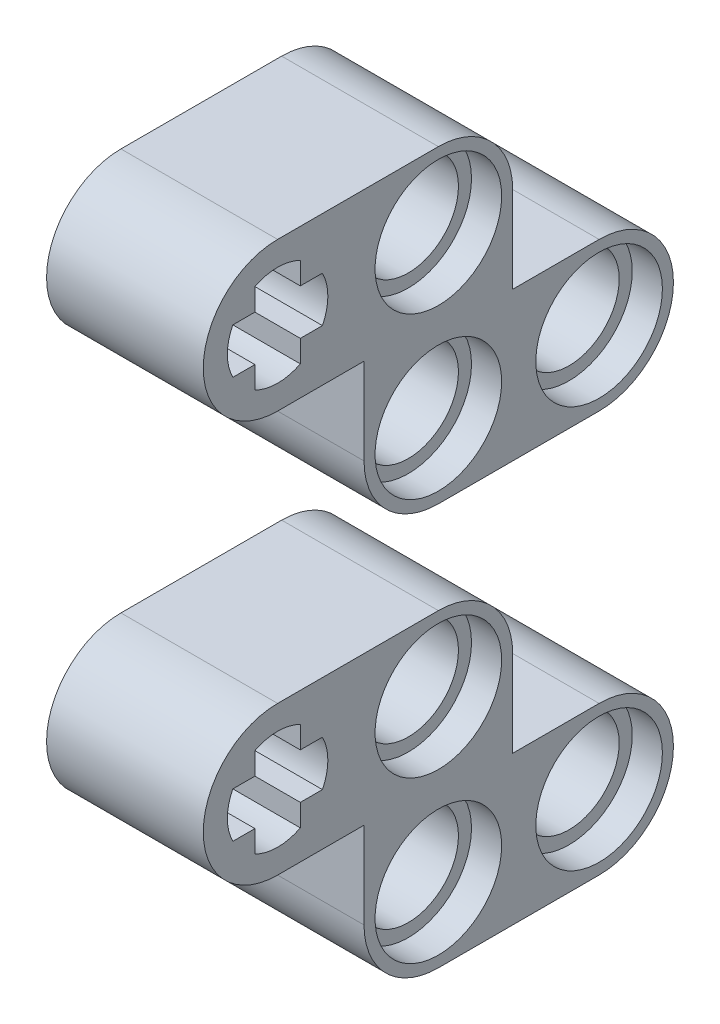
from build123d import *

# Parameters (mm, degrees)
SKETCH_1_R             = 3.7
SKETCH_1_W             = 8
SKETCH_1_H             = 7.4
SKETCH_1_W_2           = 7.4
SKETCH_1_H_2           = 8
EXTRUDE_1_DEPTH        = 7.8
SKETCH_1_3_R           = 2.5
CUT_EXTRUDE_1_DEPTH    = 25.203718723
CUT_EXTRUDE_2_DEPTH    = 1.5
CUT_EXTRUDE_START      = 7.8
CUT_EXTRUDE_3_DEPTH    = 1.5
PATTERN_LINEAR_1_COUNT = 2
PATTERN_LINEAR_1_PITCH = 20


with BuildPart() as part:
    # 草图1 → 凸台-拉伸1 (new body)
    with BuildSketch(Plane(origin=(0, 0, 0), x_dir=(0, 0, -1), z_dir=(1, 0, 0))):
        with Locations((8, 0)):
            Circle(SKETCH_1_R)
        with Locations((8, -8)):
            Circle(SKETCH_1_R)
        with Locations((16, -8)):
            Circle(SKETCH_1_R)
        Circle(SKETCH_1_R)
        with Locations((4, 0)):
            Rectangle(SKETCH_1_W, SKETCH_1_H)
        with Locations((8, -4)):
            Rectangle(SKETCH_1_W_2, SKETCH_1_H_2)
        with Locations((12, -8)):
            Rectangle(SKETCH_1_W, SKETCH_1_H)
    extrude(amount=EXTRUDE_1_DEPTH)

    # 草图1<3> → 切除-拉伸1 (cut, through all)
    with BuildSketch(Plane(origin=(0, 0, 0), x_dir=(0, 0, -1), z_dir=(1, 0, 0))):
        with BuildLine():
            ThreePointArc((-2.230029762, 1.130029762), (-2.5, 0), (-2.230029762, -1.130029762))
            Line((-2.230029762, -1.130029762), (-1.130029762, -1.130029762))
            Line((-1.130029762, -1.130029762), (-1.130029762, -2.230029762))
            ThreePointArc((-1.130029762, -2.230029762), (0, -2.5), (1.130029762, -2.230029762))
            Line((1.130029762, -2.230029762), (1.130029762, -1.130029762))
            Line((1.130029762, -1.130029762), (2.230029762, -1.130029762))
            ThreePointArc((2.230029762, -1.130029762), (2.5, 0), (2.230029762, 1.130029762))
            Line((2.230029762, 1.130029762), (1.130029762, 1.130029762))
            Line((1.130029762, 1.130029762), (1.130029762, 2.230029762))
            ThreePointArc((1.130029762, 2.230029762), (0, 2.5), (-1.130029762, 2.230029762))
            Line((-1.130029762, 2.230029762), (-1.130029762, 1.130029762))
            Line((-1.130029762, 1.130029762), (-2.230029762, 1.130029762))
        make_face()
        with Locations((8, 0)):
            Circle(SKETCH_1_3_R)
        with Locations((8, -8)):
            Circle(SKETCH_1_3_R)
        with Locations((16, -8)):
            Circle(SKETCH_1_3_R)
    extrude(amount=CUT_EXTRUDE_1_DEPTH, mode=Mode.SUBTRACT)

    # 草图1<4> → 切除-拉伸2 (cut)
    with BuildSketch(Plane(origin=(0, 0, 0), x_dir=(0, 0, -1), z_dir=(1, 0, 0))):
        with BuildLine():
            ThreePointArc((19.15, -8), (18.227386361, -5.772613639), (16, -4.85))
            Line((16, -4.85), (16, -5.5))
            ThreePointArc((16, -5.5), (17.767766953, -6.232233047), (18.5, -8))
            ThreePointArc((18.5, -8), (17.767766953, -9.767766953), (16, -10.5))
            Line((16, -10.5), (16, -11.15))
            ThreePointArc((16, -11.15), (18.227386361, -10.227386361), (19.15, -8))
        make_face()
        with BuildLine():
            Line((16, -5.5), (16, -4.85))
            ThreePointArc((16, -4.85), (12.85, -8), (16, -11.15))
            Line((16, -11.15), (16, -10.5))
            ThreePointArc((16, -10.5), (13.5, -8), (16, -5.5))
        make_face()
        with BuildLine():
            ThreePointArc((8, -4.85), (5.772613639, -5.772613639), (4.85, -8))
            Line((4.85, -8), (5.5, -8))
            ThreePointArc((5.5, -8), (6.232233047, -6.232233047), (8, -5.5))
            Line((8, -5.5), (8, -4.85))
        make_face()
        with BuildLine():
            Line((5.5, -8), (4.85, -8))
            ThreePointArc((4.85, -8), (5.772613639, -10.227386361), (8, -11.15))
            Line((8, -11.15), (8, -10.5))
            ThreePointArc((8, -10.5), (6.232233047, -9.767766953), (5.5, -8))
        make_face()
        with BuildLine():
            ThreePointArc((11.15, -8), (10.227386361, -5.772613639), (8, -4.85))
            Line((8, -4.85), (8, -5.5))
            ThreePointArc((8, -5.5), (9.767766953, -6.232233047), (10.5, -8))
            Line((10.5, -8), (11.15, -8))
        make_face()
        with BuildLine():
            Line((8, -10.5), (8, -11.15))
            ThreePointArc((8, -11.15), (10.227386361, -10.227386361), (11.15, -8))
            Line((11.15, -8), (10.5, -8))
            ThreePointArc((10.5, -8), (9.767766953, -9.767766953), (8, -10.5))
        make_face()
        with BuildLine():
            ThreePointArc((11.15, 0), (10.227386361, 2.227386361), (8, 3.15))
            Line((8, 3.15), (8, 2.5))
            ThreePointArc((8, 2.5), (9.767766953, 1.767766953), (10.5, 0))
            Line((10.5, 0), (11.15, 0))
        make_face()
        with BuildLine():
            Line((8, 2.5), (8, 3.15))
            ThreePointArc((8, 3.15), (5.772613639, 2.227386361), (4.85, 0))
            Line((4.85, 0), (5.5, 0))
            ThreePointArc((5.5, 0), (6.232233047, 1.767766953), (8, 2.5))
        make_face()
        with BuildLine():
            ThreePointArc((8, -3.15), (10.227386361, -2.227386361), (11.15, 0))
            Line((11.15, 0), (10.5, 0))
            ThreePointArc((10.5, 0), (9.767766953, -1.767766953), (8, -2.5))
            Line((8, -2.5), (8, -3.15))
        make_face()
        with BuildLine():
            Line((5.5, 0), (4.85, 0))
            ThreePointArc((4.85, 0), (5.772613639, -2.227386361), (8, -3.15))
            Line((8, -3.15), (8, -2.5))
            ThreePointArc((8, -2.5), (6.232233047, -1.767766953), (5.5, 0))
        make_face()
    extrude(amount=CUT_EXTRUDE_2_DEPTH, mode=Mode.SUBTRACT)


with BuildPart() as cut_extrude_2_kept_piece:
    # of the separate pieces the step leaves, the one the design keeps (cut_extrude_2_pieces_kept)
    add(part.part.solids().sort_by_distance((0, -11.7, -8))[0])

    # 草图1<5> → 切除-拉伸3 (cut)
    with BuildSketch(Plane(origin=(0, 0, 0), x_dir=(0, 0, -1), z_dir=(1, 0, 0)).offset(CUT_EXTRUDE_START)):
        with BuildLine():
            ThreePointArc((19.15, -8), (18.227386361, -5.772613639), (16, -4.85))
            Line((16, -4.85), (16, -5.5))
            ThreePointArc((16, -5.5), (17.767766953, -6.232233047), (18.5, -8))
            ThreePointArc((18.5, -8), (17.767766953, -9.767766953), (16, -10.5))
            Line((16, -10.5), (16, -11.15))
            ThreePointArc((16, -11.15), (18.227386361, -10.227386361), (19.15, -8))
        make_face()
        with BuildLine():
            Line((16, -5.5), (16, -4.85))
            ThreePointArc((16, -4.85), (12.85, -8), (16, -11.15))
            Line((16, -11.15), (16, -10.5))
            ThreePointArc((16, -10.5), (13.5, -8), (16, -5.5))
        make_face()
        with BuildLine():
            ThreePointArc((8, -4.85), (5.772613639, -5.772613639), (4.85, -8))
            Line((4.85, -8), (5.5, -8))
            ThreePointArc((5.5, -8), (6.232233047, -6.232233047), (8, -5.5))
            Line((8, -5.5), (8, -4.85))
        make_face()
        with BuildLine():
            Line((5.5, -8), (4.85, -8))
            ThreePointArc((4.85, -8), (5.772613639, -10.227386361), (8, -11.15))
            Line((8, -11.15), (8, -10.5))
            ThreePointArc((8, -10.5), (6.232233047, -9.767766953), (5.5, -8))
        make_face()
        with BuildLine():
            ThreePointArc((11.15, -8), (10.227386361, -5.772613639), (8, -4.85))
            Line((8, -4.85), (8, -5.5))
            ThreePointArc((8, -5.5), (9.767766953, -6.232233047), (10.5, -8))
            Line((10.5, -8), (11.15, -8))
        make_face()
        with BuildLine():
            Line((8, -10.5), (8, -11.15))
            ThreePointArc((8, -11.15), (10.227386361, -10.227386361), (11.15, -8))
            Line((11.15, -8), (10.5, -8))
            ThreePointArc((10.5, -8), (9.767766953, -9.767766953), (8, -10.5))
        make_face()
        with BuildLine():
            ThreePointArc((11.15, 0), (10.227386361, 2.227386361), (8, 3.15))
            Line((8, 3.15), (8, 2.5))
            ThreePointArc((8, 2.5), (9.767766953, 1.767766953), (10.5, 0))
            Line((10.5, 0), (11.15, 0))
        make_face()
        with BuildLine():
            Line((8, 2.5), (8, 3.15))
            ThreePointArc((8, 3.15), (5.772613639, 2.227386361), (4.85, 0))
            Line((4.85, 0), (5.5, 0))
            ThreePointArc((5.5, 0), (6.232233047, 1.767766953), (8, 2.5))
        make_face()
        with BuildLine():
            ThreePointArc((8, -3.15), (10.227386361, -2.227386361), (11.15, 0))
            Line((11.15, 0), (10.5, 0))
            ThreePointArc((10.5, 0), (9.767766953, -1.767766953), (8, -2.5))
            Line((8, -2.5), (8, -3.15))
        make_face()
        with BuildLine():
            Line((5.5, 0), (4.85, 0))
            ThreePointArc((4.85, 0), (5.772613639, -2.227386361), (8, -3.15))
            Line((8, -3.15), (8, -2.5))
            ThreePointArc((8, -2.5), (6.232233047, -1.767766953), (5.5, 0))
        make_face()
    extrude(amount=-CUT_EXTRUDE_3_DEPTH, mode=Mode.SUBTRACT)


with BuildPart() as pattern_linear_1_1:
    # 阵列(线性)1: pattern copy
    add(cut_extrude_2_kept_piece.part.moved(Location(Vector(0, 1, 0) * (1 * PATTERN_LINEAR_1_PITCH))))


solid = Compound([cut_extrude_2_kept_piece.part, pattern_linear_1_1.part])
